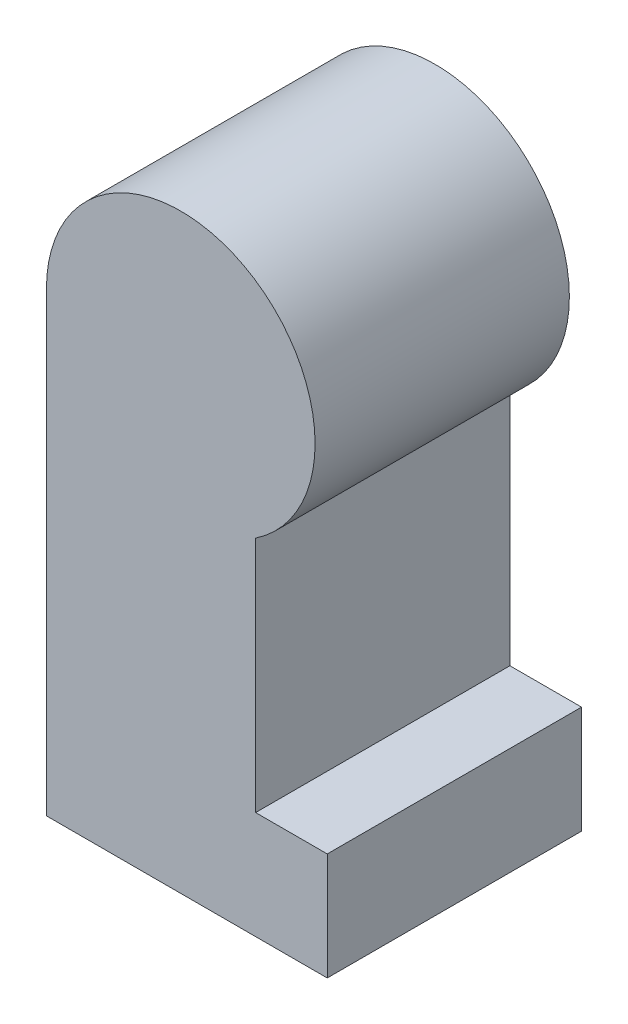
from build123d import *

# Parameters (mm, degrees)
BOSS_EXTRUDE1_DEPTH = 180.34
SKETCH2_R           = 38.1
CUT_EXTRUDE1_DEPTH  = 101.6
SKETCH3_R           = 61.722
CUT_EXTRUDE2_DEPTH  = 50.8
SKETCH4_R           = 61.722
CUT_EXTRUDE3_DEPTH  = 50.8


with BuildPart() as part:
    # Sketch1 → Boss-Extrude1 (new body)
    with BuildSketch(Plane.XY):
        with BuildLine():
            Line((-95.25, 0), (-95.25, -323.85))
            Line((-95.25, -323.85), (103.886, -323.85))
            Line((103.886, -323.85), (103.886, -247.65))
            Line((103.886, -247.65), (53.086, -247.65))
            Line((53.086, -247.65), (53.086, -79.08501188))
            ThreePointArc((53.086, -79.08501188), (44.811388062, 84.050591907), (-95.25, 0))
        make_face()
    extrude(amount=BOSS_EXTRUDE1_DEPTH)

    # Sketch2 → Cut-Extrude1 (cut)
    with BuildSketch(Plane(origin=(0, 0, 0), x_dir=(-1, 0, 0), z_dir=(0, 0, -1))):
        Circle(SKETCH2_R)
    extrude(amount=-CUT_EXTRUDE1_DEPTH, mode=Mode.SUBTRACT)

    # Sketch3 → Cut-Extrude2 (cut)
    with BuildSketch(Plane.XZ.offset(323.85)):
        with Locations(Location((4.318, 90.17, 0), (0, 0, 270))):
            Circle(SKETCH3_R)
    extrude(amount=-CUT_EXTRUDE2_DEPTH, mode=Mode.SUBTRACT)

    # Sketch4 → Cut-Extrude3 (cut)
    with BuildSketch(Plane.ZY.offset(95.25)):
        with Locations(Location((90.17, -209.55, 0), (0, 0, 270))):
            Circle(SKETCH4_R)
        with Locations(Location((90.17, -9.906, 0), (0, 0, 270))):
            Circle(SKETCH4_R)
    extrude(amount=-CUT_EXTRUDE3_DEPTH, mode=Mode.SUBTRACT)


solid = part.part
